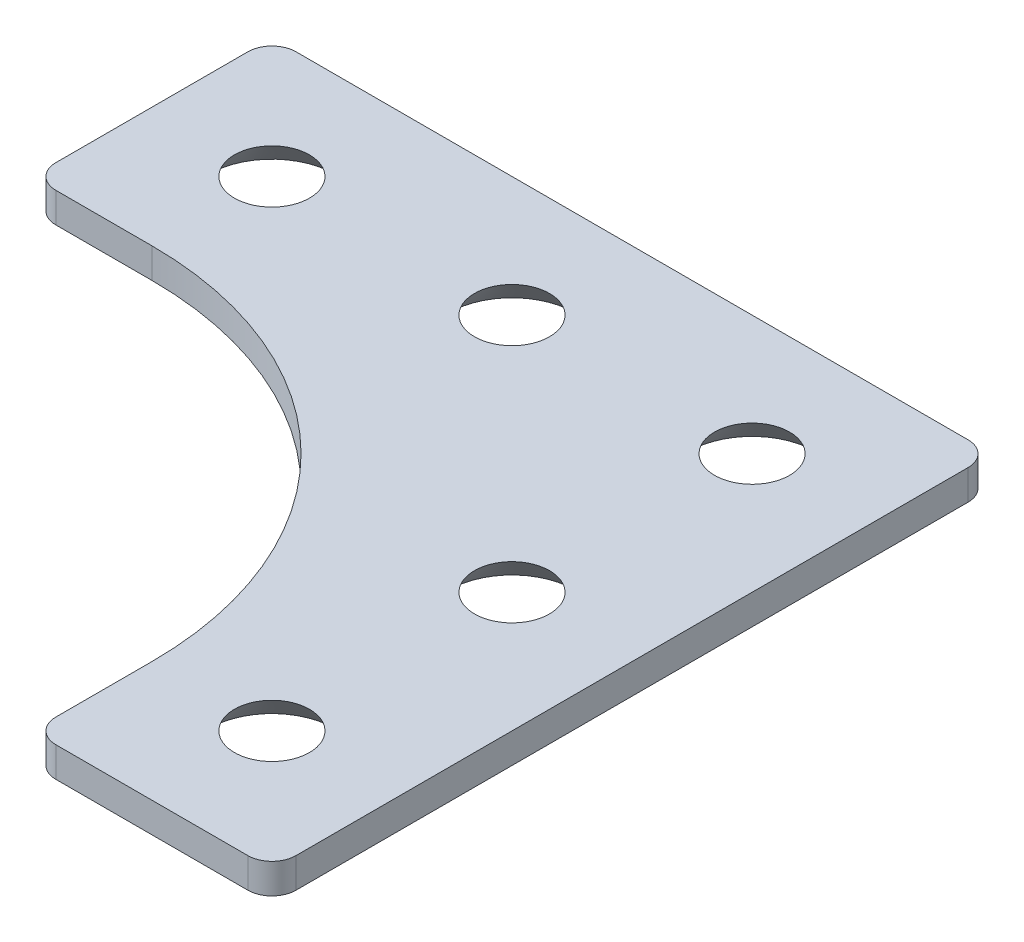
from build123d import *

# Parameters (mm, degrees)
BOSS_EXTRUDE1_DEPTH                  = 3.175
F_1_4_0_25_DIAMETER_HOLE1_AT_2_COUNT = 2
F_1_4_0_25_DIAMETER_HOLE1_AT_2_PITCH = 25.4
F_1_4_0_25_DIAMETER_HOLE1_AT_3_COUNT = 2
F_1_4_0_25_DIAMETER_HOLE1_AT_3_PITCH = 50.8
F_1_4_0_25_DIAMETER_HOLE1_AT_4_COUNT = 2
F_1_4_0_25_DIAMETER_HOLE1_AT_4_PITCH = 56.796126628
F_1_4_0_25_DIAMETER_HOLE1_AT_5_COUNT = 2
F_1_4_0_25_DIAMETER_HOLE1_AT_5_PITCH = 71.842048969


with BuildPart() as part:
    # Sketch1 → Boss-Extrude1 (new body)
    with BuildSketch(Plane(origin=(0, 0, 0), x_dir=(1, 0, 0), z_dir=(0, 1, 0))):
        with BuildLine():
            Line((274.893771244, 269.21115375), (203.773771244, 269.21115375))
            ThreePointArc((203.773771244, 269.21115375), (201.97772002, 268.467204975), (201.233771244, 266.67115375))
            Line((201.233771244, 266.67115375), (201.233771244, 246.35115375))
            ThreePointArc((201.233771244, 246.35115375), (201.97772002, 244.555102526), (203.773771244, 243.81115375))
            Line((203.773771244, 243.81115375), (213.933771244, 243.81115375))
            ThreePointArc((213.933771244, 243.81115375), (240.874539608, 232.651922114), (252.033771244, 205.71115375))
            Line((252.033771244, 205.71115375), (252.033771244, 195.55115375))
            ThreePointArc((252.033771244, 195.55115375), (252.77772002, 193.755102526), (254.573771244, 193.01115375))
            Line((254.573771244, 193.01115375), (274.893771244, 193.01115375))
            ThreePointArc((274.893771244, 193.01115375), (276.689822469, 193.755102526), (277.433771244, 195.55115375))
            Line((277.433771244, 195.55115375), (277.433771244, 266.67115375))
            ThreePointArc((277.433771244, 266.67115375), (276.689822469, 268.467204975), (274.893771244, 269.21115375))
        make_face()
    extrude(amount=BOSS_EXTRUDE1_DEPTH)

    # Sketch4 → 1/4 (0.25) Diameter Hole1 (revolve, cut)
    with BuildSketch(Plane(origin=(264.733771244, 0, -205.71115375), x_dir=(0, 0, -1), z_dir=(1, 0, 0))):
        Polygon((0, 0), (0, 3.175), (3.175, 3.175), (3.175, 4.090710056), (6.731, 0), align=None)
    f_1_4_0_25_diameter_hole1 = revolve(axis=Axis((264.733771244, -6.35, -205.71115375), (0, 1, 0)), mode=Mode.SUBTRACT)

    # 1/4 (0.25) Diameter Hole1 at 2: 1/4 (0.25) Diameter Hole1 ×2
    with Locations(*[(0, 0, -i * F_1_4_0_25_DIAMETER_HOLE1_AT_2_PITCH) for i in range(1, F_1_4_0_25_DIAMETER_HOLE1_AT_2_COUNT)]):
        add(f_1_4_0_25_diameter_hole1, mode=Mode.SUBTRACT)

    # 1/4 (0.25) Diameter Hole1 at 3: 1/4 (0.25) Diameter Hole1 ×2
    with Locations(*[(0, 0, -i * F_1_4_0_25_DIAMETER_HOLE1_AT_3_PITCH) for i in range(1, F_1_4_0_25_DIAMETER_HOLE1_AT_3_COUNT)]):
        add(f_1_4_0_25_diameter_hole1, mode=Mode.SUBTRACT)

    # 1/4 (0.25) Diameter Hole1 at 4: 1/4 (0.25) Diameter Hole1 ×2
    with Locations(*[Vector(-0.44721359549993195, 0, -0.894427190999929) * (i * F_1_4_0_25_DIAMETER_HOLE1_AT_4_PITCH) for i in range(1, F_1_4_0_25_DIAMETER_HOLE1_AT_4_COUNT)]):
        add(f_1_4_0_25_diameter_hole1, mode=Mode.SUBTRACT)

    # 1/4 (0.25) Diameter Hole1 at 5: 1/4 (0.25) Diameter Hole1 ×2
    with Locations(*[Vector(-0.7071067811865277, 0, -0.7071067811865673) * (i * F_1_4_0_25_DIAMETER_HOLE1_AT_5_PITCH) for i in range(1, F_1_4_0_25_DIAMETER_HOLE1_AT_5_COUNT)]):
        add(f_1_4_0_25_diameter_hole1, mode=Mode.SUBTRACT)


solid = part.part
